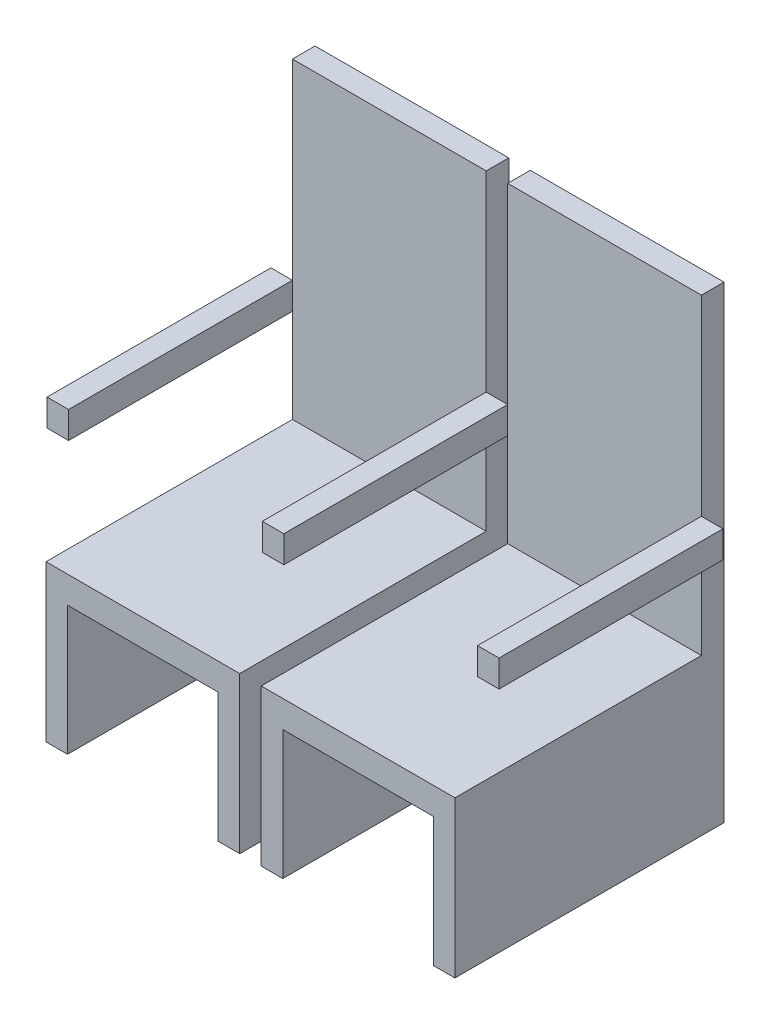
from build123d import *

# Parameters (mm, degrees)
BOSS_EXTRUDE1_DEPTH     = 368.3
BOSS_EXTRUDE1_2_DEPTH   = 368.3
SKETCH2_W               = 457.2
SKETCH2_H               = 53.34
BOSS_EXTRUDE2_DEPTH     = 736.6
SKETCH3_W               = 50.8
SKETCH3_H               = 63.5
BOSS_EXTRUDE3_DEPTH     = 528.32
BOSS_EXTRUDE3_2_DEPTH   = 528.32
BOSS_EXTRUDE3_3_DEPTH   = 528.32
CUT_EXTRUDE1_DEPTH      = 1382.500839667
CUT_EXTRUDE1_DEPTH_BACK = 1382.500839667
SKETCH4_W               = 355.6
SKETCH4_H               = 304.8
SKETCH4_W_2             = 50.8
SKETCH4_H_2             = 368.3


with BuildPart() as part:
    # Sketch1 → Boss-Extrude1 (new body)
    with BuildSketch(Plane(origin=(0, 0, 0), x_dir=(1, 0, 0), z_dir=(0, 1, 0))):
        Polygon((-533.4, 264.16), (-482.6, 264.16), (-482.6, 317.5), (-25.4, 317.5), (-25.4, -317.5), (-482.6, -317.5), (-482.6, -264.16), (-533.4, -264.16), align=None)
    extrude(amount=BOSS_EXTRUDE1_DEPTH)



with BuildPart() as body_2:
    # Sketch1 → Boss-Extrude1 2 (new body)
    with BuildSketch(Plane(origin=(0, 0, 0), x_dir=(1, 0, 0), z_dir=(0, 1, 0))):
        Polygon((25.4, -317.5), (482.6, -317.5), (482.6, -264.16), (533.4, -264.16), (533.4, 264.16), (482.6, 264.16), (482.6, 317.5), (25.4, 317.5), align=None)
    extrude(amount=BOSS_EXTRUDE1_2_DEPTH)


with BuildPart() as part_1:
    add(part.part)

    add(body_2.part)  # Boss-Extrude2 merges body 2
    # Sketch2 → Boss-Extrude2 (add)
    with BuildSketch(Plane(origin=(0, 368.3, 0), x_dir=(1, 0, 0), z_dir=(0, 1, 0))):
        with Locations((-254, 290.83)):
            Rectangle(SKETCH2_W, SKETCH2_H)
        with Locations((254, 290.83)):
            Rectangle(SKETCH2_W, SKETCH2_H)
    extrude(amount=BOSS_EXTRUDE2_DEPTH)

    # Sketch4 → Cut-Extrude1 (cut, two sides: drawn at the far end of the back side and taken through both)
    with BuildSketch(Plane.XY.offset(317.5).offset(-CUT_EXTRUDE1_DEPTH_BACK)):
        with Locations((-254, 152.4)):
            Rectangle(SKETCH4_W, SKETCH4_H)
        with Locations((-508, 184.15)):
            Rectangle(SKETCH4_W_2, SKETCH4_H_2)
        with Locations((254, 152.4)):
            Rectangle(SKETCH4_W, SKETCH4_H)
        with Locations((508, 184.15)):
            Rectangle(SKETCH4_W_2, SKETCH4_H_2)
    extrude(amount=CUT_EXTRUDE1_DEPTH + CUT_EXTRUDE1_DEPTH_BACK, mode=Mode.SUBTRACT)


with BuildPart() as body_2_2:
    # Sketch3 → Boss-Extrude3 (new body)
    with BuildSketch(Plane.XY.offset(-264.16)):
        with Locations((-508, 621.03)):
            Rectangle(SKETCH3_W, SKETCH3_H)
    extrude(amount=BOSS_EXTRUDE3_DEPTH)


with BuildPart() as body_3:
    # Sketch3 → Boss-Extrude3 2 (new body)
    with BuildSketch(Plane.XY.offset(-264.16)):
        with Locations((508, 621.03)):
            Rectangle(SKETCH3_W, SKETCH3_H)
    extrude(amount=BOSS_EXTRUDE3_2_DEPTH)


with BuildPart() as body_4:
    # Sketch3 → Boss-Extrude3 3 (new body)
    with BuildSketch(Plane.XY.offset(-264.16)):
        with Locations((0, 621.03)):
            Rectangle(SKETCH3_W, SKETCH3_H)
    extrude(amount=BOSS_EXTRUDE3_3_DEPTH)


solid = Compound([part_1.part, body_2_2.part, body_3.part, body_4.part])
